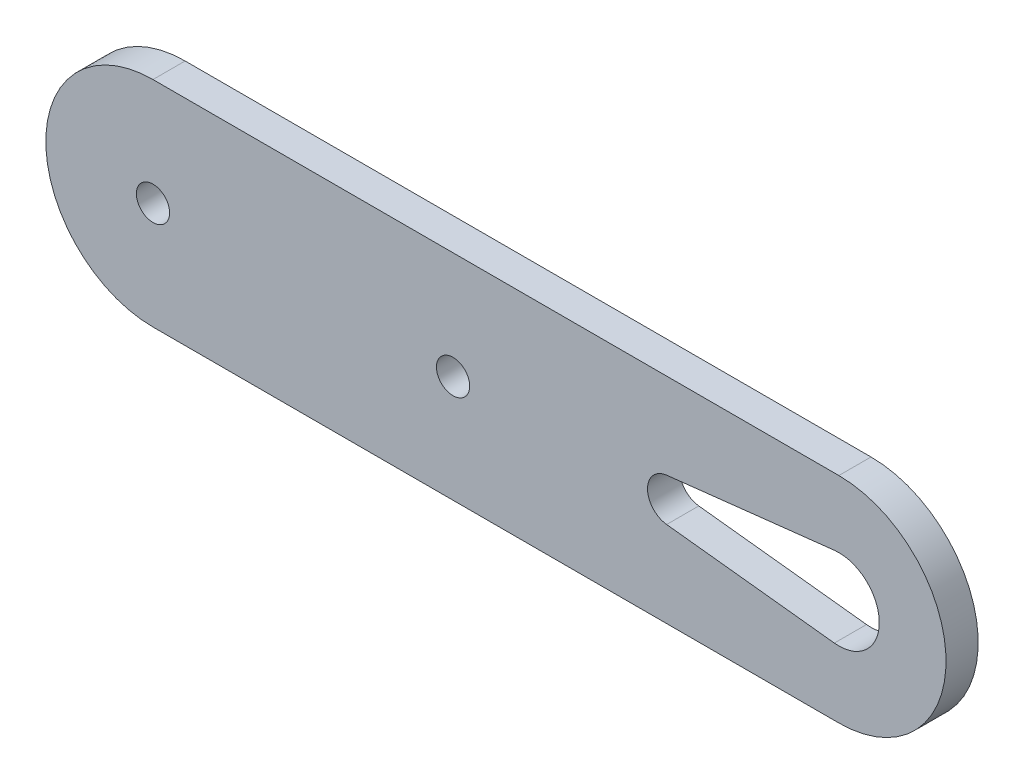
from build123d import *

# Parameters (mm, degrees)
BOSS_EXTRUDE1_DEPTH = 3
CUT_EXTRUDE1_DEPTH  = 3
SKETCH4_R           = 1.55
CUT_EXTRUDE4_DEPTH  = 3
SKETCH5_R           = 1.55
CUT_EXTRUDE6_DEPTH  = 3


with BuildPart() as part:
    # Sketch1 → Boss-Extrude1 (new body)
    with BuildSketch(Plane.XY):
        with BuildLine():
            Line((-58.058617241, 24.191090517), (5.941382759, 24.191090517))
            ThreePointArc((5.941382759, 24.191090517), (15.941382759, 14.191090517), (5.941382759, 4.191090517))
            Line((5.941382759, 4.191090517), (-58.058617241, 4.191090517))
            ThreePointArc((-58.058617241, 4.191090517), (-68.058617241, 14.191090517), (-58.058617241, 24.191090517))
        make_face()
    extrude(amount=BOSS_EXTRUDE1_DEPTH)

    # Sketch2 → Cut-Extrude1 (cut)
    with BuildSketch(Plane.XY.offset(3)):
        with BuildLine():
            Line((5.520256561, 17.941090517), (-10.129743439, 16.183590517))
            ThreePointArc((-10.129743439, 16.183590517), (-11.911009757, 14.191090517), (-10.129743439, 12.198590517))
            Line((-10.129743439, 12.198590517), (5.520256561, 10.441090517))
            ThreePointArc((5.520256561, 10.441090517), (9.714954976, 14.191090517), (5.520256561, 17.941090517))
        make_face()
    extrude(amount=-CUT_EXTRUDE1_DEPTH, mode=Mode.SUBTRACT)

    # Sketch4 → Cut-Extrude4 (cut)
    with BuildSketch(Plane(origin=(9.979459273, 1.433252018, 3), x_dir=(1, 0, 0), z_dir=(0, 0, 1))):
        with Locations((-40.038076514, 12.757838499)):
            Circle(SKETCH4_R)
    extrude(amount=-CUT_EXTRUDE4_DEPTH, mode=Mode.SUBTRACT)

    # Sketch5 → Cut-Extrude6 (cut)
    with BuildSketch(Plane(origin=(-9.979459273, 1.433252018, 0), x_dir=(-1, 0, 0), z_dir=(0, 0, -1))):
        with Locations((48.079157968, 12.757838499)):
            Circle(SKETCH5_R)
    extrude(amount=-CUT_EXTRUDE6_DEPTH, mode=Mode.SUBTRACT)


solid = part.part
